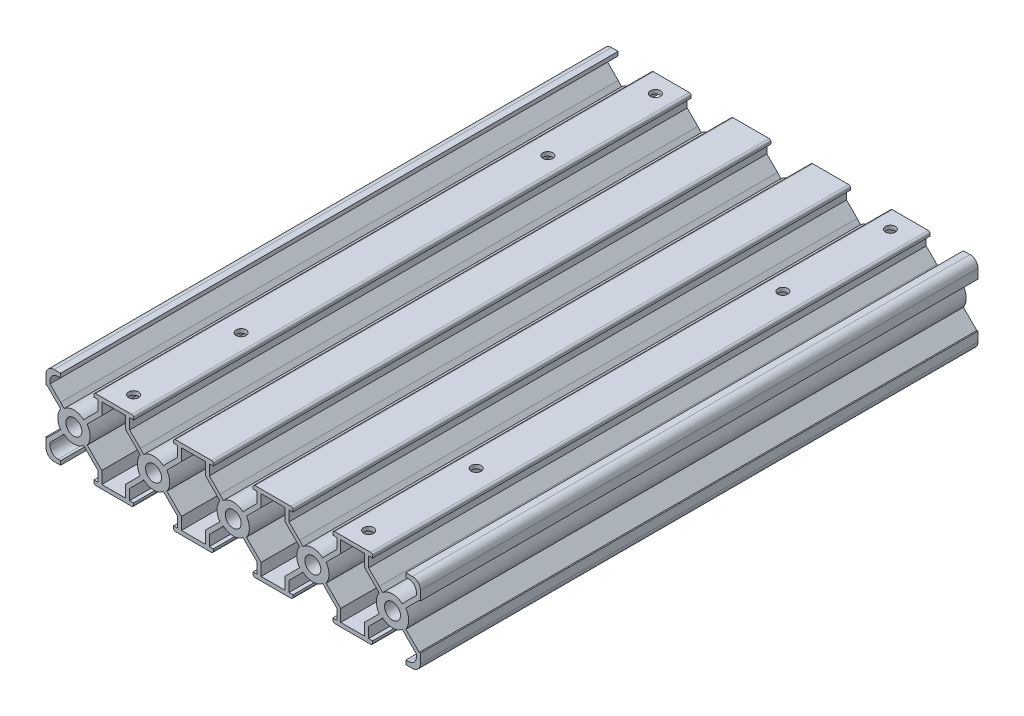
from build123d import *
from build123d.topology import SkipClean

# Parameters (mm, degrees)
SKETCH1_R                 = 2
BOSS_EXTRUDE1_DEPTH       = 140
CUT_EXTRUDE1_DEPTH        = 149.018024455
LPATTERN1_COUNT           = 5
LPATTERN1_PITCH           = 20
FILLET1_R                 = 0.5
SKETCH4_R                 = 1
CUT_EXTRUDE2_DEPTH        = 12
M3X0_5_TAPPED_HOLE1_D     = 2.5
M3X0_5_TAPPED_HOLE1_DEPTH = 11.5
M3X0_5_TAPPED_HOLE1_TIP   = 0.751075774
CUT_EXTRUDE3_DEPTH        = 150.027969064
CUT_EXTRUDE3_DEPTH_BACK   = 150.027969064
SKETCH8_R                 = 1
M3X0_5_TAPPED_HOLE2_D     = 2.5
M3X0_5_TAPPED_HOLE2_DEPTH = 7.5
M3X0_5_TAPPED_HOLE2_TIP   = 0.751075774


with BuildPart() as part:
    # Sketch1 → Boss-Extrude1 (new body)
    with BuildSketch(Plane.XY):
        with BuildLine():
            Line((36.656430311, 3.707106781), (34, 6.363537092))
            Line((34, 6.363537092), (34, 9))
            Line((34, 9), (35, 9))
            Line((35, 9), (35, 10))
            Line((35, 10), (25, 10))
            Line((25, 10), (25, 9))
            Line((25, 9), (26, 9))
            Line((26, 9), (26, 6.363537092))
            Line((26, 6.363537092), (23.343569689, 3.707106781))
            Line((23.343569689, 3.707106781), (16.656430311, 3.707106781))
            Line((16.656430311, 3.707106781), (14, 6.363537092))
            Line((14, 6.363537092), (14, 9))
            Line((14, 9), (15, 9))
            Line((15, 9), (15, 10))
            Line((15, 10), (5, 10))
            Line((5, 10), (5, 9))
            Line((5, 9), (6, 9))
            Line((6, 9), (6, 6.363537092))
            Line((6, 6.363537092), (3.343569689, 3.707106781))
            Line((3.343569689, 3.707106781), (-3.343569689, 3.707106781))
            Line((-3.343569689, 3.707106781), (-6, 6.363537092))
            Line((-6, 6.363537092), (-6, 9))
            Line((-6, 9), (-5, 9))
            Line((-5, 9), (-5, 10))
            Line((-5, 10), (-15, 10))
            Line((-15, 10), (-15, 9))
            Line((-15, 9), (-14, 9))
            Line((-14, 9), (-14, 6.363537092))
            Line((-14, 6.363537092), (-16.656430311, 3.707106781))
            Line((-16.656430311, 3.707106781), (-23.343569689, 3.707106781))
            Line((-23.343569689, 3.707106781), (-26, 6.363537092))
            Line((-26, 6.363537092), (-26, 9))
            Line((-26, 9), (-25, 9))
            Line((-25, 9), (-25, 10))
            Line((-25, 10), (-35, 10))
            Line((-35, 10), (-35, 9))
            Line((-35, 9), (-34, 9))
            Line((-34, 9), (-34, 6.363537092))
            Line((-34, 6.363537092), (-36.656430311, 3.707106781))
            Line((-36.656430311, 3.707106781), (-43.343569689, 3.707106781))
            Line((-43.343569689, 3.707106781), (-46, 6.363537092))
            Line((-46, 6.363537092), (-46, 7))
            ThreePointArc((-46, 7), (-45.414213562, 8.414213562), (-44, 9))
            Line((-44, 9), (-43.343569689, 9))
            Line((-43.343569689, 9), (-43.343569689, 10))
            Line((-43.343569689, 10), (-45.003569689, 10))
            ThreePointArc((-45.003569689, 10), (-46.417783251, 9.414213562), (-47.003569689, 8))
            Line((-47.003569689, 8), (-47.003569689, 5.656430311))
            Line((-47.003569689, 5.656430311), (-46.707106781, 5.656430311))
            Line((-46.707106781, 5.656430311), (-44.05067647, 3))
            Line((-44.05067647, 3), (-44.05067647, -3))
            Line((-44.05067647, -3), (-46.707106781, -5.656430311))
            Line((-46.707106781, -5.656430311), (-47.003569689, -5.656430311))
            Line((-47.003569689, -5.656430311), (-47.003569689, -8))
            ThreePointArc((-47.003569689, -8), (-46.417783251, -9.414213562), (-45.003569689, -10))
            Line((-45.003569689, -10), (-43.343569689, -10))
            Line((-43.343569689, -10), (-43.343569689, -9))
            Line((-43.343569689, -9), (-44, -9))
            ThreePointArc((-44, -9), (-45.414213562, -8.414213562), (-46, -7))
            Line((-46, -7), (-46, -6.363537092))
            Line((-46, -6.363537092), (-43.343569689, -3.707106781))
            Line((-43.343569689, -3.707106781), (-36.656430311, -3.707106781))
            Line((-36.656430311, -3.707106781), (-34, -6.363537092))
            Line((-34, -6.363537092), (-34, -9))
            Line((-34, -9), (-35, -9))
            Line((-35, -9), (-35, -10))
            Line((-35, -10), (-25, -10))
            Line((-25, -10), (-25, -9))
            Line((-25, -9), (-26, -9))
            Line((-26, -9), (-26, -6.363537092))
            Line((-26, -6.363537092), (-23.343569689, -3.707106781))
            Line((-23.343569689, -3.707106781), (-16.656430311, -3.707106781))
            Line((-16.656430311, -3.707106781), (-14, -6.363537092))
            Line((-14, -6.363537092), (-14, -9))
            Line((-14, -9), (-15, -9))
            Line((-15, -9), (-15, -10))
            Line((-15, -10), (-5, -10))
            Line((-5, -10), (-5, -9))
            Line((-5, -9), (-6, -9))
            Line((-6, -9), (-6, -6.363537092))
            Line((-6, -6.363537092), (-3.343569689, -3.707106781))
            Line((-3.343569689, -3.707106781), (3.343569689, -3.707106781))
            Line((3.343569689, -3.707106781), (6, -6.363537092))
            Line((6, -6.363537092), (6, -9))
            Line((6, -9), (5, -9))
            Line((5, -9), (5, -10))
            Line((5, -10), (15, -10))
            Line((15, -10), (15, -9))
            Line((15, -9), (14, -9))
            Line((14, -9), (14, -6.363537092))
            Line((14, -6.363537092), (16.656430311, -3.707106781))
            Line((16.656430311, -3.707106781), (23.343569689, -3.707106781))
            Line((23.343569689, -3.707106781), (26, -6.363537092))
            Line((26, -6.363537092), (26, -9))
            Line((26, -9), (25, -9))
            Line((25, -9), (25, -10))
            Line((25, -10), (35, -10))
            Line((35, -10), (35, -9))
            Line((35, -9), (34, -9))
            Line((34, -9), (34, -6.363537092))
            Line((34, -6.363537092), (36.656430311, -3.707106781))
            Line((36.656430311, -3.707106781), (43.343569689, -3.707106781))
            Line((43.343569689, -3.707106781), (46, -6.363537092))
            Line((46, -6.363537092), (46, -7))
            ThreePointArc((46, -7), (45.414213562, -8.414213562), (44, -9))
            Line((44, -9), (43.343569689, -9))
            Line((43.343569689, -9), (43.343569689, -10))
            Line((43.343569689, -10), (45.003569689, -10))
            ThreePointArc((45.003569689, -10), (46.417783251, -9.414213562), (47.003569689, -8))
            Line((47.003569689, -8), (47.003569689, -5.656430311))
            Line((47.003569689, -5.656430311), (46.707106781, -5.656430311))
            Line((46.707106781, -5.656430311), (44.05067647, -3))
            Line((44.05067647, -3), (44.05067647, 3))
            Line((44.05067647, 3), (46.707106781, 5.656430311))
            Line((46.707106781, 5.656430311), (47.003569689, 5.656430311))
            Line((47.003569689, 5.656430311), (47.003569689, 8))
            ThreePointArc((47.003569689, 8), (46.417783251, 9.414213562), (45.003569689, 10))
            Line((45.003569689, 10), (43.343569689, 10))
            Line((43.343569689, 10), (43.343569689, 9))
            Line((43.343569689, 9), (44, 9))
            ThreePointArc((44, 9), (45.414213562, 8.414213562), (46, 7))
            Line((46, 7), (46, 6.363537092))
            Line((46, 6.363537092), (43.343569689, 3.707106781))
            Line((43.343569689, 3.707106781), (36.656430311, 3.707106781))
        make_face()
        with Locations((-40, 0)):
            Circle(SKETCH1_R, mode=Mode.SUBTRACT)
        with Locations((-20, 0)):
            Circle(SKETCH1_R, mode=Mode.SUBTRACT)
        Circle(SKETCH1_R, mode=Mode.SUBTRACT)
        with Locations((20, 0)):
            Circle(SKETCH1_R, mode=Mode.SUBTRACT)
        with Locations((40, 0)):
            Circle(SKETCH1_R, mode=Mode.SUBTRACT)
        Polygon((-35.94932353, -3), (-33, -5.94932353), (-33, -9), (-27, -9), (-27, -5.94932353), (-24.05067647, -3), (-24.05067647, 3), (-27, 5.94932353), (-27, 9), (-33, 9), (-33, 5.94932353), (-35.94932353, 3), align=None, mode=Mode.SUBTRACT)
        Polygon((-15.94932353, 3), (-15.94932353, -3), (-13, -5.94932353), (-13, -9), (-7, -9), (-7, -5.94932353), (-4.05067647, -3), (-4.05067647, 3), (-7, 5.94932353), (-7, 9), (-13, 9), (-13, 5.94932353), align=None, mode=Mode.SUBTRACT)
        Polygon((33, -5.94932353), (33, -9), (27, -9), (27, -5.94932353), (24.05067647, -3), (24.05067647, 3), (27, 5.94932353), (27, 9), (33, 9), (33, 5.94932353), (35.94932353, 3), (35.94932353, -3), align=None, mode=Mode.SUBTRACT)
        Polygon((4.05067647, -3), (4.05067647, 3), (7, 5.94932353), (7, 9), (13, 9), (13, 5.94932353), (15.94932353, 3), (15.94932353, -3), (13, -5.94932353), (13, -9), (7, -9), (7, -5.94932353), align=None, mode=Mode.SUBTRACT)
    extrude(amount=BOSS_EXTRUDE1_DEPTH)

    # Sketch3 → Cut-Extrude1 (cut, through all)
    with BuildSketch(Plane(origin=(0, 0, 0), x_dir=(-1, 0, 0), z_dir=(0, 0, -1))):
        with BuildLine():
            Line((-40, 3.707106781), (-43.343569689, 3.707106781))
            Line((-43.343569689, 3.707106781), (-42.482865348, 2.752820436))
            ThreePointArc((-42.482865348, 2.752820436), (-41.329970184, 3.460320794), (-40, 3.707106781))
        make_face()
        with BuildLine():
            Line((-36.656430311, 3.707106781), (-40, 3.707106781))
            ThreePointArc((-40, 3.707106781), (-38.670029816, 3.460320794), (-37.517134652, 2.752820436))
            Line((-37.517134652, 2.752820436), (-36.656430311, 3.707106781))
        make_face()
        with BuildLine():
            Line((-35.94932353, 0), (-35.94932353, 3))
            Line((-35.94932353, 3), (-36.658989612, 2.290333918))
            ThreePointArc((-36.658989612, 2.290333918), (-36.130805509, 1.198880249), (-35.94932353, 0))
        make_face()
        with BuildLine():
            Line((-35.94932353, -3), (-35.94932353, 0))
            ThreePointArc((-35.94932353, 0), (-36.130805509, -1.198880249), (-36.658989612, -2.290333918))
            Line((-36.658989612, -2.290333918), (-35.94932353, -3))
        make_face()
        with BuildLine():
            Line((-39.99999999, -3.707106781), (-36.656430311, -3.707106781))
            Line((-36.656430311, -3.707106781), (-37.517134652, -2.752820436))
            ThreePointArc((-37.517134652, -2.752820436), (-38.670029811, -3.460320792), (-39.99999999, -3.707106781))
        make_face()
        with BuildLine():
            Line((-43.343569689, -3.707106781), (-39.99999999, -3.707106781))
            ThreePointArc((-39.99999999, -3.707106781), (-41.32997018, -3.460320796), (-42.482865348, -2.752820436))
            Line((-42.482865348, -2.752820436), (-43.343569689, -3.707106781))
        make_face()
        with BuildLine():
            ThreePointArc((-43.341010388, -2.290333918), (-43.869194491, -1.198880249), (-44.05067647, 0))
            Line((-44.05067647, 0), (-44.05067647, -3))
            Line((-44.05067647, -3), (-43.341010388, -2.290333918))
        make_face()
        with BuildLine():
            Line((-43.341010388, 2.290333918), (-44.05067647, 3))
            Line((-44.05067647, 3), (-44.05067647, 0))
            ThreePointArc((-44.05067647, 0), (-43.869194491, 1.198880249), (-43.341010388, 2.290333918))
        make_face()
    cut_extrude1 = extrude(amount=-CUT_EXTRUDE1_DEPTH, mode=Mode.SUBTRACT)

    # LPattern1: Cut-Extrude1 ×5
    with Locations(*[(-i * LPATTERN1_PITCH, 0, 0) for i in range(1, LPATTERN1_COUNT)]):
        add(cut_extrude1, mode=Mode.SUBTRACT)

    # Fillet1
    fillet1_edges = [part.edges().sort_by_distance(p)[0] for p in [
        (35, -10, 70),
        (25, -10, 70),
        (15, -10, 70),
        (5, -10, 70),
        (-5, -10, 70),
        (-15, -10, 70),
        (-25, -10, 70),
        (-35, -10, 70),
        (-35, 10, 70),
        (-25, 10, 70),
        (-15, 10, 70),
        (-5, 10, 70),
        (5, 10, 70),
        (15, 10, 70),
        (25, 10, 70),
        (35, 10, 70),
    ]]
    fillet(fillet1_edges, radius=FILLET1_R)

    # Sketch4 → Cut-Extrude2 (cut)
    with BuildSketch(Plane(origin=(0, 10, 0), x_dir=(1, 0, 0), z_dir=(0, 1, 0))):
        with Locations(Location((-29.503569689, -108.5, 0), (0, 0, 180))):
            Circle(SKETCH4_R)
        with Locations(Location((-29.503569689, -135.5, 0), (0, 0, 180))):
            Circle(SKETCH4_R)
        with Locations(Location((-29.503569689, -4.5, 0), (0, 0, 180))):
            Circle(SKETCH4_R)
        with Locations(Location((-29.503569689, -31.5, 0), (0, 0, 180))):
            Circle(SKETCH4_R)
        with Locations(Location((29.503569689, -31.5, 0), (0, 0, 180))):
            Circle(SKETCH4_R)
        with Locations(Location((29.503569689, -4.5, 0), (0, 0, 180))):
            Circle(SKETCH4_R)
        with Locations(Location((29.503569689, -108.5, 0), (0, 0, 180))):
            Circle(SKETCH4_R)
        with Locations(Location((29.503569689, -135.5, 0), (0, 0, 180))):
            Circle(SKETCH4_R)
    extrude(amount=-CUT_EXTRUDE2_DEPTH, mode=Mode.SUBTRACT)

    # M3x0.5 Tapped Hole1
    with Locations(Plane(origin=(-29.503569689, 10, 135.5), x_dir=(1, 0, 0), z_dir=(0, 1, 0))):
        with Locations((0, 0), (0, 27), (0, 131), (0, 104), (59.007139378, 131), (59.007139378, 104), (59.007139378, 27), (59.007139378, 0)):
            Hole(M3X0_5_TAPPED_HOLE1_D / 2, depth=M3X0_5_TAPPED_HOLE1_DEPTH)
            with Locations((0, 0, -(M3X0_5_TAPPED_HOLE1_DEPTH + M3X0_5_TAPPED_HOLE1_TIP / 2))):  # 118° drill point
                Cone(0, M3X0_5_TAPPED_HOLE1_D / 2, M3X0_5_TAPPED_HOLE1_TIP, mode=Mode.SUBTRACT)

    # Sketch8 → Cut-Extrude3 (cut, two sides: drawn at the far end of the back side and taken through both)
    with SkipClean():  # the faces are left unmerged after this step: merging them gives an invalid solid
        with BuildSketch(Plane.XZ.offset(10).offset(-CUT_EXTRUDE3_DEPTH_BACK)):
            with Locations((0, 56.5)):
                Circle(SKETCH8_R)
            with Locations((0, 83.5)):
                Circle(SKETCH8_R)
        extrude(amount=CUT_EXTRUDE3_DEPTH + CUT_EXTRUDE3_DEPTH_BACK, mode=Mode.SUBTRACT)

    # M3x0.5 Tapped Hole2
    with Locations(Plane(origin=(0, 10, 56.5), x_dir=(1, 0, 0), z_dir=(0, 1, 0))):
        with Locations((0, 0), (0, -27)):
            Hole(M3X0_5_TAPPED_HOLE2_D / 2, depth=M3X0_5_TAPPED_HOLE2_DEPTH)
            with Locations((0, 0, -(M3X0_5_TAPPED_HOLE2_DEPTH + M3X0_5_TAPPED_HOLE2_TIP / 2))):  # 118° drill point
                Cone(0, M3X0_5_TAPPED_HOLE2_D / 2, M3X0_5_TAPPED_HOLE2_TIP, mode=Mode.SUBTRACT)


solid = part.part
